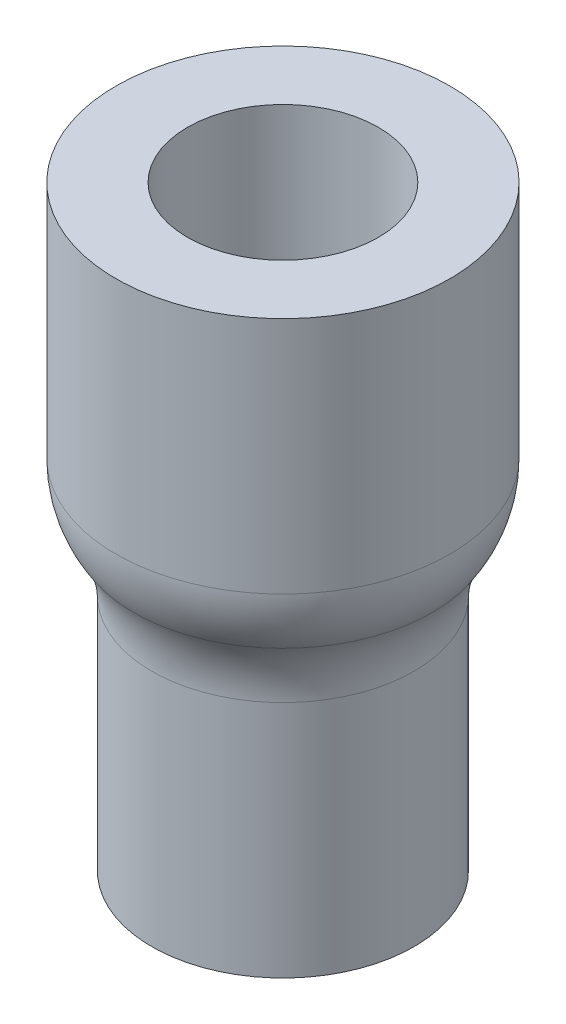
from build123d import *


with BuildPart() as part:
    # Sketch1 → Revolve1 (revolve)
    with BuildSketch(Plane.XY, mode=Mode.PRIVATE) as revolve1_sk:
        with BuildLine():
            Line((2.5, 0), (2.5, 10))
            ThreePointArc((2.5, 10), (2.691538955, 11.305038314), (3.25, 12.5))
            ThreePointArc((3.25, 12.5), (3.808461045, 13.694961686), (4, 15))
            Line((4, 15), (4, 25))
            Line((4, 25), (7, 25))
            Line((7, 25), (7, 15))
            ThreePointArc((7, 15), (6.808461045, 13.694961686), (6.25, 12.5))
            ThreePointArc((6.25, 12.5), (5.691538955, 11.305038314), (5.5, 10))
            Line((5.5, 10), (5.5, 0))
            Line((5.5, 0), (2.5, 0))
        make_face()
    revolve(revolve1_sk.sketch.rotate(Axis((0, 0, 0), (0, 1, 0)), 90), axis=Axis((0, 0, 0), (0, 1, 0)))


solid = part.part
